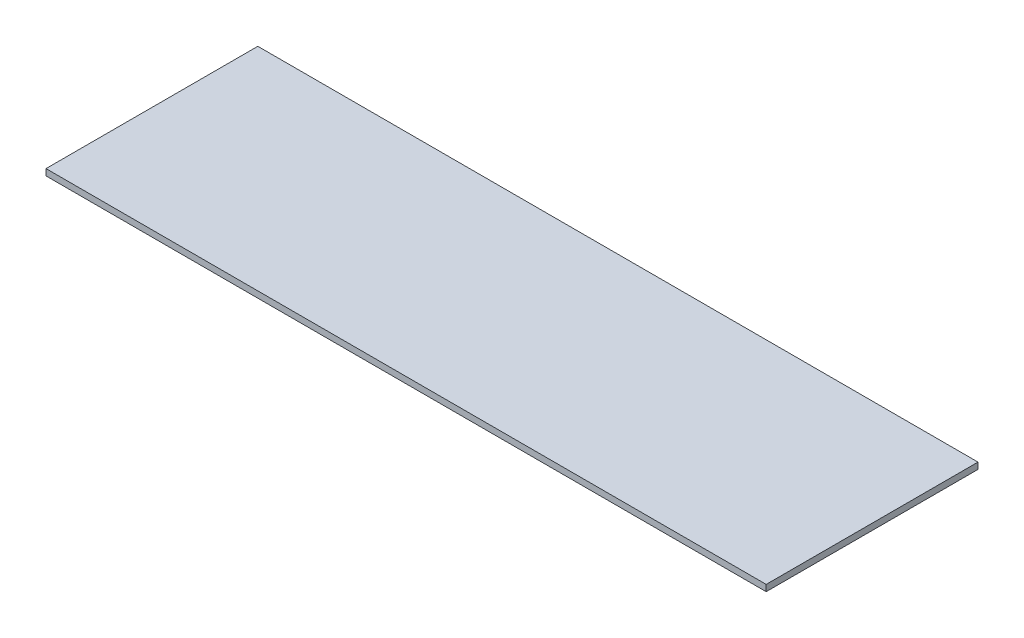
from build123d import *

# Parameters (mm, degrees)
ESQUISSE1_W        = 2040
ESQUISSE1_H        = 600
BOSS_EXTRU_1_DEPTH = 18


with BuildPart() as part:
    # Esquisse1 → Boss.-Extru.1 (new body)
    with BuildSketch(Plane(origin=(0, 0, 0), x_dir=(1, 0, 0), z_dir=(0, 1, 0))):
        with Locations((1020, 300)):
            Rectangle(ESQUISSE1_W, ESQUISSE1_H)
    extrude(amount=BOSS_EXTRU_1_DEPTH)


solid = part.part
